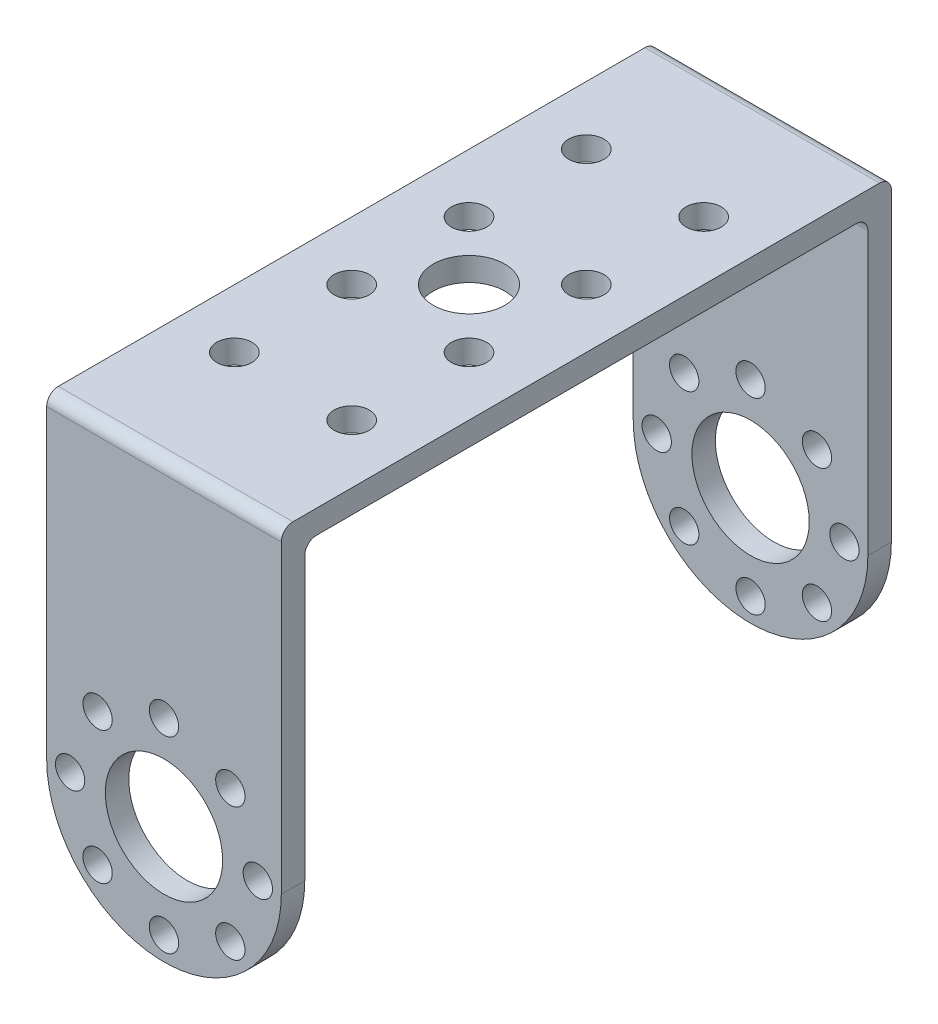
from build123d import *

# Parameters (mm, degrees)
EXTRUDE_1_DEPTH          = 20
FILLET_1_R               = 1
CUT_EXTRUDE_1_DEPTH      = 50000
SKETCH_3_R               = 5
CUT_EXTRUDE_2_DEPTH      = 500
SKETCH_4_R               = 1.25
CUT_EXTRUDE_3_DEPTH      = 5000
PATTERN_CIRCULAR_1_COUNT = 8
SKETCH_5_R               = 3.05
SKETCH_5_R_2             = 1.5
CUT_EXTRUDE_4_DEPTH      = 5000


with BuildPart() as part:
    # 草图1 → 凸台-拉伸1 (new body)
    with BuildSketch(Plane(origin=(0, 0, 0), x_dir=(0, 0, -1), z_dir=(1, 0, 0))):
        Polygon((-24, -18.5), (-24, 16.5), (24, 16.5), (24, -18.5), (26, -18.5), (26, 18.5), (-26, 18.5), (-26, -18.5), align=None)
    extrude(amount=EXTRUDE_1_DEPTH)

    # 圆角1
    fillet_1_edges = [part.edges().sort_by_distance(p)[0] for p in [
        (10, 16.5, -24),
        (10, 16.5, 24),
        (10, 18.5, 26),
        (10, 18.5, -26),
    ]]
    fillet(fillet_1_edges, radius=FILLET_1_R)

    # 草图2 → 切除-拉伸1 (cut)
    with BuildSketch(Plane.XY.offset(26)):
        with BuildLine():
            ThreePointArc((10, -18.5), (2.928932188, -15.571067812), (0, -8.5))
            Line((0, -8.5), (0, -18.5))
            Line((0, -18.5), (10, -18.5))
        make_face()
        with BuildLine():
            ThreePointArc((20, -8.5), (17.071067812, -15.571067812), (10, -18.5))
            Line((10, -18.5), (20, -18.5))
            Line((20, -18.5), (20, -8.5))
        make_face()
    extrude(amount=-CUT_EXTRUDE_1_DEPTH, mode=Mode.SUBTRACT)

    # 草图3 → 切除-拉伸2 (cut)
    with BuildSketch(Plane.XY.offset(26)):
        with Locations((10, -8.5)):
            Circle(SKETCH_3_R)
    extrude(amount=-CUT_EXTRUDE_2_DEPTH, mode=Mode.SUBTRACT)

    # 草图4 → 切除-拉伸3 (cut)
    with BuildSketch(Plane.XY.offset(26)):
        with Locations((18, -8.5)):
            Circle(SKETCH_4_R)
    cut_extrude_3 = extrude(amount=-CUT_EXTRUDE_3_DEPTH, mode=Mode.SUBTRACT)

    # 阵列(圆周)1: 切除-拉伸3 ×8 about axis
    pattern_circular_1_axis = Axis((10, -8.5, 0), (0, 0, 1))
    for i in range(1, PATTERN_CIRCULAR_1_COUNT):
        add(cut_extrude_3.rotate(pattern_circular_1_axis, i * 360 / PATTERN_CIRCULAR_1_COUNT), mode=Mode.SUBTRACT)

    # 草图5 → 切除-拉伸4 (cut)
    with BuildSketch(Plane(origin=(0, 18.5, 0), x_dir=(1, 0, 0), z_dir=(0, 1, 0))):
        with Locations(Location((10, 0, 0), (0, 0, 270))):
            Circle(SKETCH_5_R)
        with Locations(Location((15, 15, 0), (0, 0, 270))):
            Circle(SKETCH_5_R_2)
        with Locations(Location((5, 15, 0), (0, 0, 270))):
            Circle(SKETCH_5_R_2)
        with Locations(Location((5, 5, 0), (0, 0, 270))):
            Circle(SKETCH_5_R_2)
        with Locations(Location((15, 5, 0), (0, 0, 270))):
            Circle(SKETCH_5_R_2)
        with Locations(Location((15, -5, 0), (0, 0, 270))):
            Circle(SKETCH_5_R_2)
        with Locations(Location((5, -5, 0), (0, 0, 270))):
            Circle(SKETCH_5_R_2)
        with Locations(Location((5, -15, 0), (0, 0, 270))):
            Circle(SKETCH_5_R_2)
        with Locations(Location((15, -15, 0), (0, 0, 270))):
            Circle(SKETCH_5_R_2)
    extrude(amount=-CUT_EXTRUDE_4_DEPTH, mode=Mode.SUBTRACT)


solid = part.part
